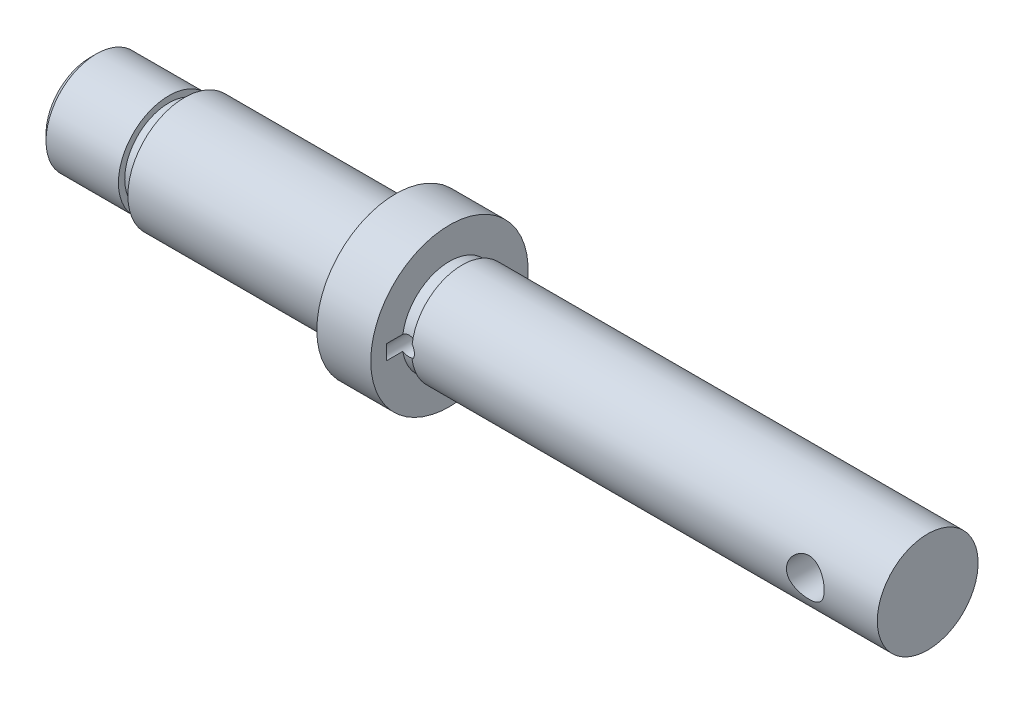
from build123d import *

# Parameters (mm, degrees)
CUT_EXTRUDE_1_DEPTH      = 135.169668703
CUT_EXTRUDE_1_DEPTH_BACK = 135.169668703
SKETCH_4_R               = 3
SKETCH_5_R               = 1.5
CUT_EXTRUDE_2_DEPTH      = 10
CHAMFER_1_SIZE           = 1


with BuildPart() as part:
    # 草图1 → 旋转1 (revolve)
    with BuildSketch(Plane.XY, mode=Mode.PRIVATE) as revolve_1_sk:
        Polygon((0, 0), (0, 8), (-73.934886909, 8), (-73.934886909, 7.5), (-75.934886909, 7.5), (-75.934886909, 12.5), (-84.5, 12.5), (-84.5, 8.5), (-86.5, 8.5), (-86.5, 9), (-118, 9), (-118, 7), (-120.5, 7), (-120.5, 8), (-133, 8), (-133, 0), align=None)
    revolve(revolve_1_sk.sketch.rotate(Axis((0, 0, 0), (1, 0, 0)), 90), axis=Axis((0, 0, 0), (1, 0, 0)))

    # 草图3 → 切除-旋转3 (revolve, cut)
    with BuildSketch(Plane.XY, mode=Mode.PRIVATE) as cut_revolve_3_sk:
        with BuildLine():
            Line((-133, 3.866025404), (-131.5, 3))
            Line((-131.5, 3), (-125, 3))
            Line((-125, 3), (-125, 1.5))
            Line((-125, 1.5), (-75, 1.5))
            ThreePointArc((-75, 1.5), (-73.939339828, 1.060660172), (-73.5, 0))
            Line((-73.5, 0), (-133, 0))
            Line((-133, 0), (-133, 3.866025404))
        make_face()
    revolve(cut_revolve_3_sk.sketch.rotate(Axis((-133, 0, 0), (1, 0, 0)), 90), axis=Axis((-133, 0, 0), (1, 0, 0)), mode=Mode.SUBTRACT)

    # 草图4 → 切除-拉伸1 (cut, two sides: drawn at the far end of the back side and taken through both)
    with BuildSketch(Plane.XY.offset(-CUT_EXTRUDE_1_DEPTH_BACK)):
        with Locations((-11.434886909, 0)):
            Circle(SKETCH_4_R)
    extrude(amount=CUT_EXTRUDE_1_DEPTH + CUT_EXTRUDE_1_DEPTH_BACK, mode=Mode.SUBTRACT)

    # 草图5 → 切除-拉伸2 (cut)
    with BuildSketch(Plane.XY):
        with Locations((-75, 0)):
            Circle(SKETCH_5_R)
    extrude(amount=CUT_EXTRUDE_2_DEPTH, mode=Mode.SUBTRACT)

    # 倒角1
    chamfer_1_edges = [part.edges().sort_by_distance(p)[0] for p in [
        (-133, 0, -8),
    ]]
    chamfer(chamfer_1_edges, length=CHAMFER_1_SIZE)


solid = part.part
